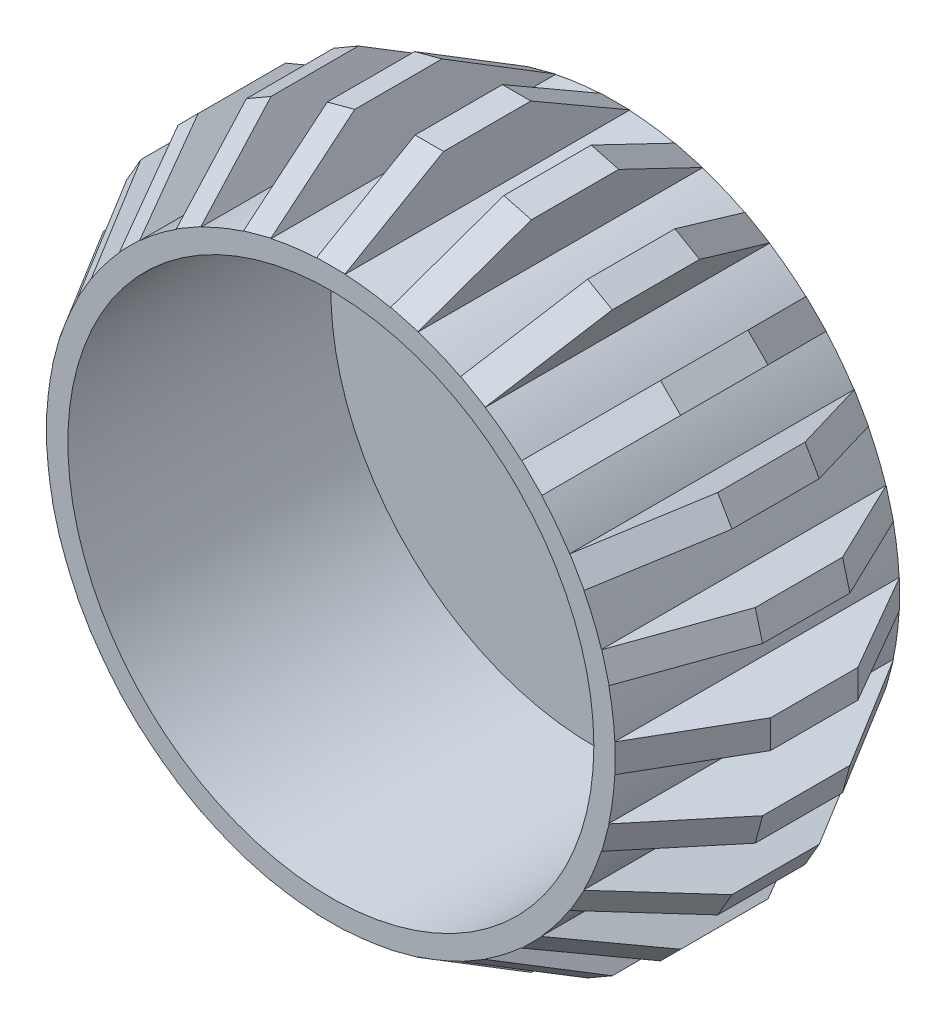
from build123d import *

# Parameters (mm, degrees)
SKETCH1_R           = 20
SKETCH1_R_2         = 2.5
BOSS_EXTRUDE1_DEPTH = 1.5
SKETCH2_R           = 20
SKETCH2_R_2         = 18.5
BOSS_EXTRUDE2_DEPTH = 18.5
SKETCH4_W           = 5
SKETCH4_H           = 2
BOSS_EXTRUDE3_DEPTH = 20
CIRPATTERN2_COUNT   = 24
CHAMFER4_SIZE       = 4
CHAMFER4_SIZE2      = 6.92820323
CHAMFER5_SIZE       = 4
CHAMFER5_SIZE2      = 6.92820323


with BuildPart() as part:
    # Sketch1 → Boss-Extrude1 (new body)
    with BuildSketch(Plane.XY):
        Circle(SKETCH1_R)
        Circle(SKETCH1_R_2, mode=Mode.SUBTRACT)
    extrude(amount=BOSS_EXTRUDE1_DEPTH)

    # Sketch2 → Boss-Extrude2 (add)
    with BuildSketch(Plane.XY.offset(1.5)):
        Circle(SKETCH2_R)
        Circle(SKETCH2_R_2, mode=Mode.SUBTRACT)
    extrude(amount=BOSS_EXTRUDE2_DEPTH)

    # Sketch4 → Boss-Extrude3 (add)
    with BuildSketch(Plane(origin=(0, 0, 0), x_dir=(-1, 0, 0), z_dir=(0, 0, -1))):
        with Locations((-21.5, 0)):
            Rectangle(SKETCH4_W, SKETCH4_H)
    boss_extrude3 = extrude(amount=-BOSS_EXTRUDE3_DEPTH)

    # CirPattern2: Boss-Extrude3 ×24 about axis
    cirpattern2_axis = Axis((0, 0, 0), (0, 0, 1))
    for i in range(1, CIRPATTERN2_COUNT):
        add(boss_extrude3.rotate(cirpattern2_axis, i * 360 / CIRPATTERN2_COUNT))

    # Chamfer4
    chamfer4_edges = [part.edges().sort_by_distance(p)[0] for p in [
        (6.211657082, -23.182219831, 20),
        (0, -24, 20),
        (-6.211657082, -23.182219831, 20),
        (-12, -20.784609691, 20),
        (-16.970562748, -16.970562748, 20),
        (-20.784609691, -12, 20),
        (24, 0, 20),
        (-23.182219831, -6.211657082, 20),
        (-24, 0, 20),
        (-23.182219831, 6.211657082, 20),
        (-20.784609691, 12, 20),
        (-16.970562748, 16.970562748, 20),
        (-12, 20.784609691, 20),
        (-6.211657082, 23.182219831, 20),
        (0, 24, 20),
        (6.211657082, 23.182219831, 20),
        (12, 20.784609691, 20),
        (16.970562748, 16.970562748, 20),
        (23.182219831, -6.211657082, 20),
        (20.784609691, 12, 20),
        (23.182219831, 6.211657082, 20),
        (20.784609691, -12, 20),
        (16.970562748, -16.970562748, 20),
        (12, -20.784609691, 20),
    ]]
    chamfer4_side = [part.faces().sort_by_distance(p)[0] for p in [
        (-21.987492178, -0.32117749, 20),
    ]]
    chamfer(chamfer4_edges, length=CHAMFER4_SIZE, length2=CHAMFER4_SIZE2, reference=chamfer4_side[0])

    # Chamfer5
    chamfer5_edges = [part.edges().sort_by_distance(p)[0] for p in [
        (6.211657082, -23.182219831, 0),
        (0, -24, 0),
        (-6.211657082, -23.182219831, 0),
        (-12, -20.784609691, 0),
        (-16.970562748, -16.970562748, 0),
        (24, 0, 0),
        (-20.784609691, -12, 0),
        (-23.182219831, -6.211657082, 0),
        (-24, 0, 0),
        (-23.182219831, 6.211657082, 0),
        (-20.784609691, 12, 0),
        (-16.970562748, 16.970562748, 0),
        (-12, 20.784609691, 0),
        (-6.211657082, 23.182219831, 0),
        (0, 24, 0),
        (6.211657082, 23.182219831, 0),
        (12, 20.784609691, 0),
        (23.182219831, -6.211657082, 0),
        (16.970562748, 16.970562748, 0),
        (20.784609691, 12, 0),
        (23.182219831, 6.211657082, 0),
        (20.784609691, -12, 0),
        (16.970562748, -16.970562748, 0),
        (12, -20.784609691, 0),
    ]]
    chamfer5_side = [part.faces().sort_by_distance(p)[0] for p in [
        (-21.987492178, -0.32117749, 0),
    ]]
    chamfer(chamfer5_edges, length=CHAMFER5_SIZE, length2=CHAMFER5_SIZE2, reference=chamfer5_side[0])


solid = part.part
